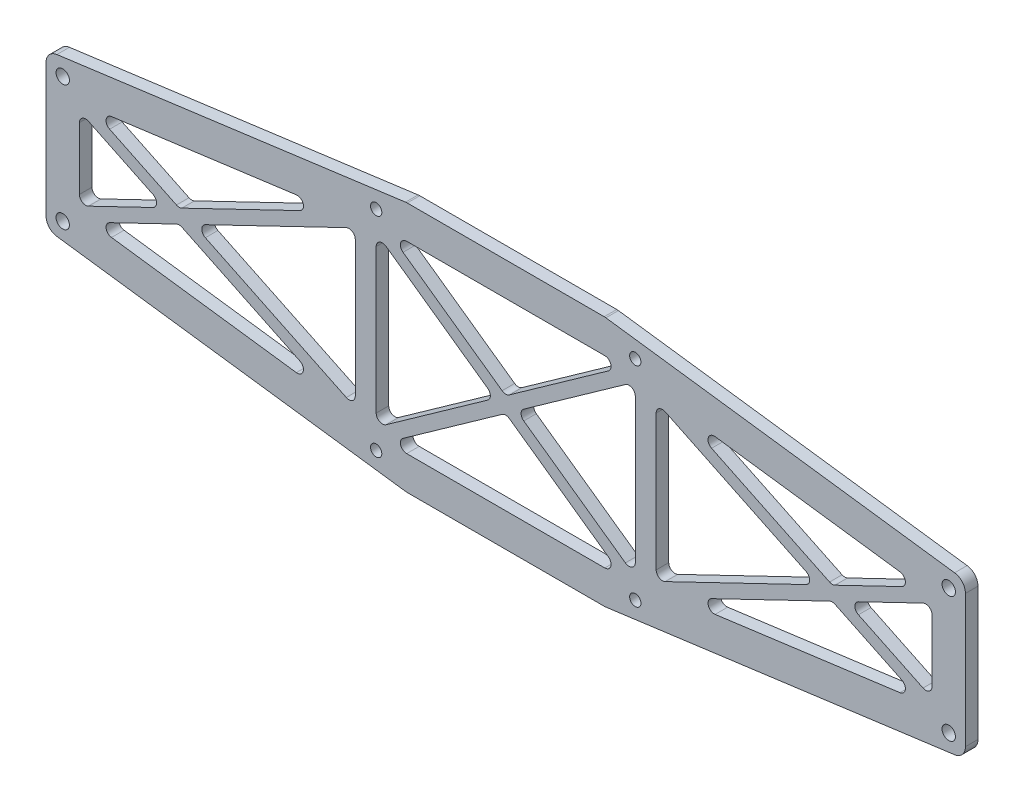
from build123d import *

# Parameters (mm, degrees)
SKETCH_1_R          = 1.35
SKETCH_1_R_2        = 1.6
EXTRUDE_1_DEPTH     = 1.5
FILLET_1_R          = 3
CUT_EXTRUDE_1_DEPTH = 6.5
FILLET_2_R          = 1.5


with BuildPart() as part:
    # 草图1 → 凸台-拉伸1 (new, symmetric)
    with BuildSketch(Plane.XY):
        Polygon((-110, 18.502065587), (-110, -18.502065587), (-23.765491901, -30), (23.765491901, -30), (110, -18.502065587), (110, 18.502065587), (23.765491901, 30), (-23.765491901, 30), align=None)
        with Locations((-31, 25)):
            Circle(SKETCH_1_R, mode=Mode.SUBTRACT)
        with Locations((31, 25)):
            Circle(SKETCH_1_R, mode=Mode.SUBTRACT)
        with Locations((-31, -25)):
            Circle(SKETCH_1_R, mode=Mode.SUBTRACT)
        with Locations((31, -25)):
            Circle(SKETCH_1_R, mode=Mode.SUBTRACT)
        with Locations((-106, 15)):
            Circle(SKETCH_1_R_2, mode=Mode.SUBTRACT)
        with Locations((-106, -15)):
            Circle(SKETCH_1_R_2, mode=Mode.SUBTRACT)
        with Locations(Location((106, -15, 0), (0, 0, 180))):
            Circle(SKETCH_1_R_2, mode=Mode.SUBTRACT)
        with Locations(Location((106, 15, 0), (0, 0, 180))):
            Circle(SKETCH_1_R_2, mode=Mode.SUBTRACT)
    extrude(amount=EXTRUDE_1_DEPTH, both=True)

    # 圆角1
    fillet_1_edges = [part.edges().sort_by_distance(p)[0] for p in [
        (23.765491901, -30, 0),
        (-23.765491901, -30, 0),
        (-110, -18.502065587, 0),
        (-110, 18.502065587, 0),
        (-23.765491901, 30, 0),
        (23.765491901, 30, 0),
        (110, 18.502065587, 0),
        (110, -18.502065587, 0),
    ]]
    fillet(fillet_1_edges, radius=FILLET_1_R)

    # 草图2 → 切除-拉伸1 (cut, symmetric)
    with BuildSketch(Plane.XY.offset(1.5)):
        Polygon((-99.293086989, 11.858856148), (-78.133261722, 1.66499219), (-40.778661074, 19.660779603), align=None)
        Polygon((-74.677168531, 0), (-35.999998999, -18.632942356), (-35.999998999, 18.632942356), align=None)
        Polygon((-99.293086989, -11.858856148), (-40.778661074, -19.660779603), (-78.133261722, -1.66499219), align=None)
        Polygon((-102, -9.832942223), (-81.589354914, 0), (-102, 9.832942223), align=None)
        Polygon((-30.999998999, 20.160653741), (-30.999998999, -20.160653741), (-2.591806009, 0), align=None)
        Polygon((-28.40819299, 22), (0, 1.839346259), (28.40819299, 22), align=None)
        Polygon((30.999998999, 20.160653741), (2.591806009, 0), (30.999998999, -20.160653741), align=None)
        Polygon((0, -1.839346259), (-28.40819299, -22), (28.40819299, -22), align=None)
        Polygon((35.999998999, -18.632942356), (74.677168531, 0), (35.999998999, 18.632942356), align=None)
        Polygon((78.133261722, 1.66499219), (99.293086989, 11.858856148), (40.778661074, 19.660779603), align=None)
        Polygon((102, 9.832942223), (81.589354914, 0), (102, -9.832942223), align=None)
        Polygon((99.293086989, -11.858856148), (78.133261722, -1.66499219), (40.778661074, -19.660779603), align=None)
    extrude(amount=CUT_EXTRUDE_1_DEPTH, both=True, mode=Mode.SUBTRACT)

    # 圆角2
    fillet_2_edges = [part.edges().sort_by_distance(p)[0] for p in [
        (2.591806009, 0, 0),
        (30.999998999, 20.160653741, 0),
        (30.999998999, -20.160653741, 0),
        (0, 1.839346259, 0),
        (-28.40819299, 22, 0),
        (28.40819299, 22, 0),
        (-28.40819299, -22, 0),
        (0, -1.839346259, 0),
        (28.40819299, -22, 0),
        (35.999998999, -18.632942356, 0),
        (35.999998999, 18.632942356, 0),
        (74.677168531, 0, 0),
        (-78.133261722, -1.66499219, 0),
        (-40.778661074, -19.660779603, 0),
        (-99.293086989, -11.858856148, 0),
        (-74.677168531, 0, 0),
        (-35.999998999, 18.632942356, 0),
        (-35.999998999, -18.632942356, 0),
        (-102, -9.832942223, 0),
        (-102, 9.832942223, 0),
        (-81.589354914, 0, 0),
        (-30.999998999, -20.160653741, 0),
        (-30.999998999, 20.160653741, 0),
        (-2.591806009, 0, 0),
        (40.778661074, -19.660779603, 0),
        (78.133261722, -1.66499219, 0),
        (99.293086989, -11.858856148, 0),
        (40.778661074, 19.660779603, 0),
        (99.293086989, 11.858856148, 0),
        (78.133261722, 1.66499219, 0),
        (102, 9.832942223, 0),
        (102, -9.832942223, 0),
        (81.589354914, 0, 0),
        (-99.293086989, 11.858856148, 0),
        (-40.778661074, 19.660779603, 0),
        (-78.133261722, 1.66499219, 0),
    ]]
    fillet(fillet_2_edges, radius=FILLET_2_R)


solid = part.part
